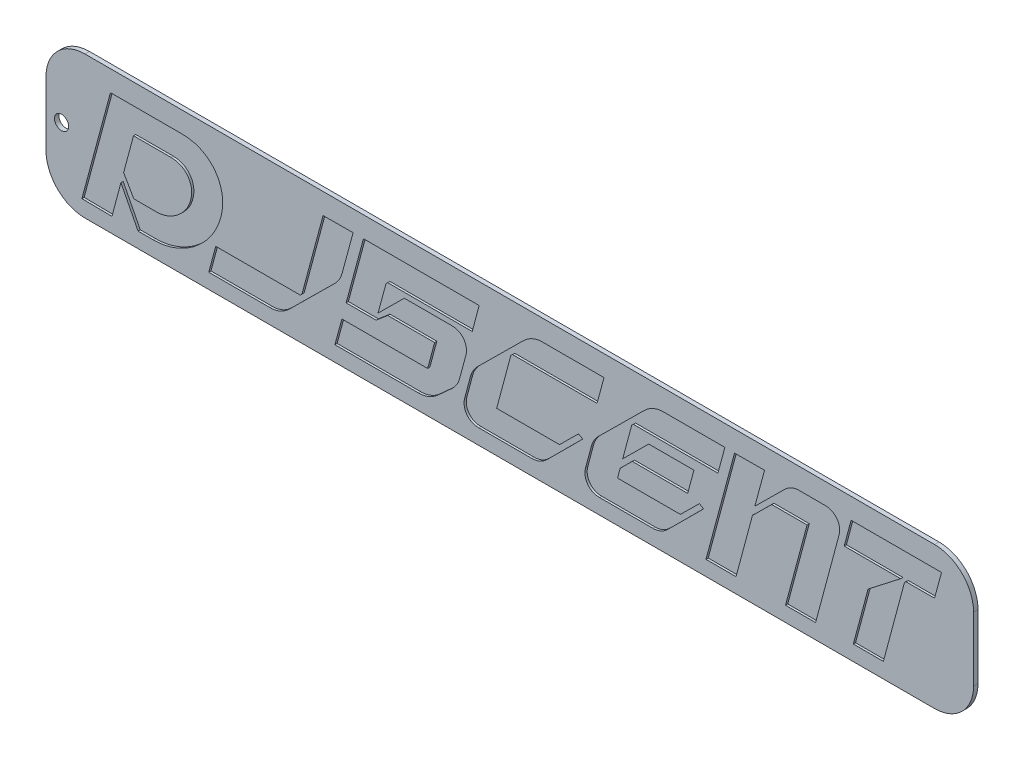
from build123d import *

# Parameters (mm, degrees)
SKETCH1_R           = 5.08
BOSS_EXTRUDE1_DEPTH = 3.175
CUT_EXTRUDE1_DEPTH  = 1.5875


with BuildPart() as part:
    # Sketch1 → Boss-Extrude1 (new body)
    with BuildSketch(Plane.XY):
        with BuildLine():
            Line((-2.764141927, 90.936625215), (605.615617234, 90.936625215))
            ThreePointArc((605.615617234, 90.936625215), (625.3721807, 82.753188682), (633.555617234, 62.996625215))
            Line((633.555617234, 62.996625215), (633.555617234, 17.11091705))
            ThreePointArc((633.555617234, 17.11091705), (625.3721807, -2.645646417), (605.615617234, -10.82908295))
            Line((605.615617234, -10.82908295), (-2.764141927, -10.82908295))
            ThreePointArc((-2.764141927, -10.82908295), (-22.520705393, -2.645646417), (-30.704141927, 17.11091705))
            Line((-30.704141927, 17.11091705), (-30.704141927, 62.996625215))
            ThreePointArc((-30.704141927, 62.996625215), (-22.520705393, 82.753188682), (-2.764141927, 90.936625215))
        make_face()
        with Locations((-19.559430626, 40.053771132)):
            Circle(SKETCH1_R, mode=Mode.SUBTRACT)
    extrude(amount=BOSS_EXTRUDE1_DEPTH)

    # Sketch2 → Cut-Extrude1 (cut)
    # profile 1 of 7: a face of its own
    with BuildSketch(Plane.XY.offset(3.175)):
        with BuildLine():
            add(Edge.make_bspline(
                [(66.52755418, 76.089907121), (67.372046712, 76.074563137), (69.038183134, 76.044290317), (71.489589408, 75.812285952), (73.845177593, 75.390891794), (76.117142602, 74.853952709), (78.292207484, 74.123799588), (80.378486199, 73.238050653), (82.376877109, 72.205541894), (84.266662619, 71.004514799), (86.036664601, 69.671624878), (87.680567722, 68.227807443), (89.16165676, 66.653649777), (90.528332882, 64.990829421), (91.717934334, 63.185445615), (92.780666176, 61.281570002), (93.673962142, 59.248927318), (94.442092708, 57.122681404), (95.058969633, 54.916479497), (95.475759652, 52.646760168), (95.755304974, 50.335546754), (95.818025954, 47.968966832), (95.751332865, 45.550704159), (95.469056183, 43.088680838), (95.05013987, 40.56989186), (94.434408682, 38.029814448), (93.662114402, 35.485257913), (92.755633009, 32.972704117), (91.694961723, 30.512238042), (90.499744842, 28.098479964), (89.144621863, 25.734962281), (87.627485234, 23.430297223), (85.992884695, 21.152887344), (84.207829513, 18.951907167), (82.307792362, 16.836425189), (80.32466496, 14.814740203), (78.252117947, 12.919218972), (76.097089586, 11.12686239), (73.864836797, 9.451422185), (71.530987286, 7.905177139), (69.133677175, 6.455977404), (66.654599677, 5.140210603), (64.134521609, 3.964590867), (61.591692305, 2.941376078), (59.050830919, 2.052719211), (56.490834784, 1.345608044), (53.92810321, 0.793616553), (51.359979832, 0.401456803), (48.786467063, 0.155160065), (47.067869031, 0.125127109), (46.20755418, 0.110092879)],
                knots=[0, 0, 0, 0, 1.003930024, 1.980697652, 2.923385203, 3.847007251, 4.753628863, 5.647304237, 6.53934812, 7.424638552, 8.305927004, 9.171336687, 10.022193025, 10.87293522, 11.726867652, 12.588904283, 13.46220048, 14.363170224, 15.274961464, 16.181968607, 17.104264897, 18.039671939, 18.993766563, 19.978002109, 20.983169548, 22.027755318, 23.082610034, 24.14332209, 25.201485874, 26.266236942, 27.343879609, 28.438137729, 29.545224554, 30.675317922, 31.805222221, 32.92466118, 34.040711709, 35.142751948, 36.255892392, 37.357015791, 38.469719939, 39.584987061, 40.691968618, 41.774107702, 42.842409923, 43.890318653, 44.929386156, 45.957177089, 46.977381066, 48, 48, 48, 48], degree=3))
            Line((46.20755418, 0.110092879), (35.229721362, 0.110092879))
            Line((35.229721362, 0.110092879), (22.946501548, 24.031702786))
            Line((22.946501548, 24.031702786), (16.529659443, -0.110092879))
            Line((16.529659443, -0.110092879), (-5.001362229, 0.110092879))
            Line((-5.001362229, 0.110092879), (15.444458204, 76.089907121))
            Line((15.444458204, 76.089907121), (66.52755418, 76.089907121))
        make_face()
        with BuildLine():
            add(Edge.make_bspline(
                [(63.539318885, 24.299071207), (64.123361521, 24.778148003), (65.275103398, 25.722895482), (66.851663558, 27.266675021), (68.249643028, 28.899453309), (69.522947593, 30.577102489), (70.607093678, 32.35200104), (71.545592756, 34.193383799), (72.290973634, 36.122833261), (72.904507078, 38.08617619), (73.347213085, 40.051989801), (73.5916202, 41.975246756), (73.613716997, 43.824219923), (73.494305733, 45.60113709), (73.114412945, 47.290466295), (72.583941957, 48.91615916), (71.839686114, 50.466372683), (70.89433666, 51.91182426), (69.819584889, 53.257039485), (68.587831137, 54.420401782), (67.232835591, 55.415036936), (65.746326529, 56.21072894), (64.140883349, 56.855077394), (62.403668964, 57.28057906), (60.544245451, 57.558163088), (59.262496591, 57.59237237), (58.600866873, 57.61003096)],
                knots=[0, 0, 0, 0, 1.195095478, 2.356748335, 3.486132587, 4.594569455, 5.685984208, 6.773133445, 7.860852384, 8.95516448, 10.026046227, 11.045862362, 12.016715015, 12.948937795, 13.85695938, 14.748996516, 15.650742299, 16.568978341, 17.477303105, 18.369340241, 19.242227615, 20.129506361, 21.030794017, 21.972530458, 22.953434527, 24, 24, 24, 24], degree=3))
            Line((58.600866873, 57.61003096), (31.958390093, 57.61003096))
            Line((31.958390093, 57.61003096), (24.896718266, 31.203467492))
            Line((24.896718266, 31.203467492), (32.178575851, 18.58996904))
            Line((32.178575851, 18.58996904), (48.157770898, 18.58996904))
            add(Edge.make_bspline(
                [(48.157770898, 18.58996904), (48.834963529, 18.608962724), (50.184069689, 18.646802026), (52.188714512, 18.92573168), (54.165085905, 19.360934592), (56.104399242, 19.99820026), (58.016085011, 20.808450529), (59.906542844, 21.77825385), (61.755156819, 22.954450814), (62.937100682, 23.845213964), (63.539318885, 24.299071207)],
                knots=[0, 0, 0, 0, 0.971579504, 1.935584991, 2.899326218, 3.872419268, 4.860319757, 5.876520275, 6.918055092, 8, 8, 8, 8], degree=3))
        make_face(mode=Mode.SUBTRACT)
    # profile 2 of 7: a face of its own
    with BuildSketch(Plane.XY.offset(3.175)):
        with BuildLine():
            Line((167.702910217, 75.979814241), (189.218204334, 76.089907121))
            Line((189.218204334, 76.089907121), (181.401609907, 47.182662539))
            add(Edge.make_bspline(
                [(181.401609907, 47.182662539), (181.148974403, 46.339319712), (180.643546052, 44.652108821), (179.415455317, 42.266911666), (177.885461761, 39.983388952), (176.609458265, 38.625916589), (175.959876161, 37.934860681)],
                knots=[0, 0, 0, 0, 0.971438497, 1.94348201, 2.953077097, 4, 4, 4, 4], degree=3))
            Line((175.959876161, 37.934860681), (143.891393189, 6.196656347))
            add(Edge.make_bspline(
                [(143.891393189, 6.196656347), (143.365831062, 5.693326875), (142.337804807, 4.708788826), (140.672643334, 3.439883558), (138.981839967, 2.336437681), (137.233540932, 1.437364182), (135.431150151, 0.737281505), (133.578125119, 0.254801864), (131.681938002, -0.061311318), (130.398415372, -0.093759348), (129.752321981, -0.110092879)],
                knots=[0, 0, 0, 0, 1.097274323, 2.146324394, 3.153497661, 4.1405882, 5.107243582, 6.064727515, 7.025831931, 8, 8, 8, 8], degree=3))
            Line((129.752321981, -0.110092879), (85.840990712, -0.110092879))
            Line((85.840990712, -0.110092879), (90.842352941, 18.479876161))
            Line((90.842352941, 18.479876161), (151.393436533, 18.479876161))
            Line((151.393436533, 18.479876161), (152.58873065, 19.675170279))
            Line((152.58873065, 19.675170279), (167.702910217, 75.979814241))
        make_face()
    # profile 3 of 7: a face of its own
    with BuildSketch(Plane.XY.offset(3.175)):
        with BuildLine():
            Line((214.020557276, 57.49993808), (212.809535604, 56.304643963))
            Line((212.809535604, 56.304643963), (207.053250774, 35.119628483))
            Line((207.053250774, 35.119628483), (225.863405573, 53.803962848))
            Line((225.863405573, 53.803962848), (259.772012384, 53.803962848))
            add(Edge.make_bspline(
                [(259.772012384, 53.803962848), (260.228797235, 53.792536655), (261.120241453, 53.770237725), (262.417437426, 53.577414152), (263.636727991, 53.264495868), (264.774066422, 52.825289363), (265.823260925, 52.256984862), (266.776163423, 51.548204168), (267.662687397, 50.734643286), (268.437524179, 49.79006535), (269.119210499, 48.773848382), (269.657801448, 47.678870984), (270.050593045, 46.5260999), (270.305194191, 45.321874174), (270.407593633, 44.065632036), (270.398792306, 42.757932078), (270.218335828, 41.392968483), (269.998251725, 40.480925875), (269.884829721, 40.010897833)],
                knots=[0, 0, 0, 0, 1.087139332, 2.121620428, 3.114679227, 4.079000668, 5.01744495, 5.946209128, 6.900133268, 7.875060797, 8.847908392, 9.808100651, 10.771290354, 11.74076863, 12.730763032, 13.76689966, 14.849154885, 16, 16, 16, 16], degree=3))
            Line((269.884829721, 40.010897833), (265.433931889, 23.591331269))
            add(Edge.make_bspline(
                [(265.433931889, 23.591331269), (265.182709387, 22.773271161), (264.678240967, 21.130562064), (263.426983646, 18.840139037), (261.846010447, 16.682431718), (260.5469083, 15.42657403), (259.882105263, 14.783900929)],
                knots=[0, 0, 0, 0, 0.970695336, 1.949208918, 2.950527376, 4, 4, 4, 4], degree=3))
            Line((259.882105263, 14.783900929), (250.319752322, 6.086563467))
            add(Edge.make_bspline(
                [(250.319752322, 6.086563467), (249.777653868, 5.60949808), (248.713172031, 4.67271725), (247.000765226, 3.470110923), (245.277410875, 2.416407118), (243.49155523, 1.579966816), (241.67414936, 0.909720101), (239.803843417, 0.463976892), (237.904802036, 0.161676246), (236.622236745, 0.127371698), (235.97622291, 0.110092879)],
                knots=[0, 0, 0, 0, 1.088269915, 2.136961561, 3.151199837, 4.13085782, 5.106263281, 6.066978306, 7.026358528, 8, 8, 8, 8], degree=3))
            Line((235.97622291, 0.110092879), (176.18006192, 0.110092879))
            Line((176.18006192, 0.110092879), (181.181424149, 18.58996904))
            Line((181.181424149, 18.58996904), (242.59752322, 18.58996904))
            Line((242.59752322, 18.58996904), (247.598885449, 37.17993808))
            Line((247.598885449, 37.17993808), (214.020557276, 37.17993808))
            Line((214.020557276, 37.17993808), (205.747863777, 30.118266254))
            Line((205.747863777, 30.118266254), (184.232569659, 30.118266254))
            Line((184.232569659, 30.118266254), (196.625882353, 76.089907121))
            Line((196.625882353, 76.089907121), (279.462910217, 76.089907121))
            Line((279.462910217, 76.089907121), (274.555913313, 57.49993808))
            Line((274.555913313, 57.49993808), (214.020557276, 57.49993808))
        make_face()
    # profile 4 of 7: a face of its own
    with BuildSketch(Plane.XY.offset(3.175)):
        with BuildLine():
            Line((303.353065015, 57.61003096), (302.157770898, 56.414736842))
            Line((302.157770898, 56.414736842), (292.04495356, 18.58996904))
            Line((292.04495356, 18.58996904), (337.057213622, 18.58996904))
            Line((337.057213622, 18.58996904), (350.645820433, 32.068482972))
            Line((350.645820433, 32.068482972), (353.68123839, 30.322724458))
            Line((353.68123839, 30.322724458), (328.029597523, 4.781176471))
            add(Edge.make_bspline(
                [(328.029597523, 4.781176471), (327.633266989, 4.40563779), (326.856078214, 3.669221032), (325.586307927, 2.72983858), (324.294121277, 1.922007685), (322.967225193, 1.249330178), (321.591786548, 0.749693532), (320.185853978, 0.386207664), (318.742039624, 0.157196007), (317.765585027, 0.125909425), (317.271950464, 0.110092879)],
                knots=[0, 0, 0, 0, 1.087710149, 2.132957327, 3.142311131, 4.123953504, 5.092881289, 6.053713067, 7.016078678, 8, 8, 8, 8], degree=3))
            Line((317.271950464, 0.110092879), (279.226996904, 0.110092879))
            add(Edge.make_bspline(
                [(279.226996904, 0.110092879), (278.770211077, 0.121495697), (277.878764955, 0.143749009), (276.581582553, 0.336897705), (275.366980441, 0.647440779), (274.238421993, 1.086514673), (273.208763493, 1.669343073), (272.235339213, 2.337531495), (271.369730793, 3.167267257), (270.6030024, 4.11011912), (269.945021087, 5.138224272), (269.427143746, 6.234858978), (269.020365153, 7.369301457), (268.794149875, 8.568042434), (268.679141028, 9.811604079), (268.716874511, 11.108834081), (268.88752335, 12.453440135), (269.110110305, 13.3493112), (269.224272446, 13.80879257)],
                knots=[0, 0, 0, 0, 1.094945795, 2.136855229, 3.137044923, 4.096584279, 5.030749513, 5.969051044, 6.920650617, 7.894578144, 8.878114772, 9.839711021, 10.797931648, 11.759527897, 12.756631189, 13.787866602, 14.865423694, 16, 16, 16, 16], degree=3))
            Line((269.224272446, 13.80879257), (273.250526316, 28.922972136))
            add(Edge.make_bspline(
                [(273.250526316, 28.922972136), (273.51226104, 29.762249011), (274.037110847, 31.445229009), (275.315795229, 33.789754209), (276.844888304, 36.050838621), (278.13039495, 37.371021477), (278.786625387, 38.04495356)],
                knots=[0, 0, 0, 0, 0.975136166, 1.955415087, 2.956272335, 4, 4, 4, 4], degree=3))
            Line((278.786625387, 38.04495356), (310.855108359, 69.798885449))
            add(Edge.make_bspline(
                [(310.855108359, 69.798885449), (311.3812917, 70.301463912), (312.407534861, 71.281669234), (314.060301474, 72.559024637), (315.744674897, 73.662817435), (317.494157, 74.531301715), (319.271052523, 75.247349918), (321.105730167, 75.724007994), (322.980543696, 76.040497331), (324.248450589, 76.073408073), (324.884086687, 76.089907121)],
                knots=[0, 0, 0, 0, 1.104987577, 2.155115633, 3.169368792, 4.159784375, 5.118388166, 6.074904324, 7.034897349, 8, 8, 8, 8], degree=3))
            Line((324.884086687, 76.089907121), (368.905510836, 76.089907121))
            Line((368.905510836, 76.089907121), (363.904148607, 57.61003096))
            Line((363.904148607, 57.61003096), (303.353065015, 57.61003096))
        make_face()
    # profile 5 of 7: a face of its own
    with BuildSketch(Plane.XY.offset(3.175)):
        with BuildLine():
            Line((389.91752322, 57.61003096), (388.722229102, 56.414736842))
            Line((388.722229102, 56.414736842), (382.305386997, 32.39876161))
            Line((382.305386997, 32.39876161), (400.895356037, 50.878637771))
            Line((400.895356037, 50.878637771), (433.294117647, 50.878637771))
            Line((433.294117647, 50.878637771), (428.843219814, 34.238885449))
            Line((428.843219814, 34.238885449), (389.162600619, 34.238885449))
            Line((389.162600619, 34.238885449), (380.465263158, 25.651640867))
            Line((380.465263158, 25.651640867), (378.609411765, 18.58996904))
            Line((378.609411765, 18.58996904), (423.621671827, 18.58996904))
            Line((423.621671827, 18.58996904), (437.210278638, 32.068482972))
            Line((437.210278638, 32.068482972), (440.245696594, 30.322724458))
            Line((440.245696594, 30.322724458), (414.594055728, 4.781176471))
            add(Edge.make_bspline(
                [(414.594055728, 4.781176471), (414.197725193, 4.40563779), (413.420536418, 3.669221032), (412.150766132, 2.72983858), (410.858579482, 1.922007685), (409.531683398, 1.249330178), (408.156244752, 0.749693532), (406.750312183, 0.386207664), (405.306497828, 0.157196007), (404.330043231, 0.125909425), (403.836408669, 0.110092879)],
                knots=[0, 0, 0, 0, 1.087710149, 2.132957327, 3.142311131, 4.123953504, 5.092881289, 6.053713067, 7.016078678, 8, 8, 8, 8], degree=3))
            Line((403.836408669, 0.110092879), (365.791455108, 0.110092879))
            add(Edge.make_bspline(
                [(365.791455108, 0.110092879), (365.334669281, 0.121495697), (364.443223159, 0.143749009), (363.146040757, 0.336897705), (361.931438645, 0.647440779), (360.802880197, 1.086514673), (359.773221697, 1.669343073), (358.799797417, 2.337531495), (357.934188998, 3.167267257), (357.167460604, 4.11011912), (356.509479291, 5.138224272), (355.991601951, 6.234858978), (355.584823357, 7.369301457), (355.358608079, 8.568042434), (355.243599232, 9.811604079), (355.281332716, 11.108834081), (355.451981554, 12.453440135), (355.674568509, 13.3493112), (355.78873065, 13.80879257)],
                knots=[0, 0, 0, 0, 1.094945795, 2.136855229, 3.137044923, 4.096584279, 5.030749513, 5.969051044, 6.920650617, 7.894578144, 8.878114772, 9.839711021, 10.797931648, 11.759527897, 12.756631189, 13.787866602, 14.865423694, 16, 16, 16, 16], degree=3))
            Line((355.78873065, 13.80879257), (359.81498452, 28.922972136))
            add(Edge.make_bspline(
                [(359.81498452, 28.922972136), (360.076719244, 29.762249011), (360.601569052, 31.445229009), (361.880253433, 33.789754209), (363.409346508, 36.050838621), (364.694853155, 37.371021477), (365.351083591, 38.04495356)],
                knots=[0, 0, 0, 0, 0.975136166, 1.955415087, 2.956272335, 4, 4, 4, 4], degree=3))
            Line((365.351083591, 38.04495356), (397.419566563, 69.798885449))
            add(Edge.make_bspline(
                [(397.419566563, 69.798885449), (397.945749904, 70.301463912), (398.971993066, 71.281669234), (400.624759678, 72.559024637), (402.309133101, 73.662817435), (404.058615204, 74.531301715), (405.835510727, 75.247349918), (407.670188371, 75.724007994), (409.5450019, 76.040497331), (410.812908794, 76.073408073), (411.448544892, 76.089907121)],
                knots=[0, 0, 0, 0, 1.104987577, 2.155115633, 3.169368792, 4.159784375, 5.118388166, 6.074904324, 7.034897349, 8, 8, 8, 8], degree=3))
            Line((411.448544892, 76.089907121), (455.46996904, 76.089907121))
            Line((455.46996904, 76.089907121), (450.468606811, 57.61003096))
            Line((450.468606811, 57.61003096), (389.91752322, 57.61003096))
        make_face()
    # profile 6 of 7: a face of its own
    with BuildSketch(Plane.XY.offset(3.175)):
        with BuildLine():
            add(Edge.make_bspline(
                [(527.030340557, 75.979814241), (527.487125412, 75.96838805), (528.378569637, 75.946089122), (529.67576556, 75.753265531), (530.895056305, 75.440347312), (532.032394095, 75.001140575), (533.081590906, 74.432836909), (534.034484843, 73.724053119), (534.921041789, 72.910504162), (535.695752281, 71.965880548), (536.377908919, 70.949833691), (536.912578585, 69.858693237), (537.309375922, 68.718158749), (537.563378718, 67.529264566), (537.666039261, 66.288698388), (537.656842914, 64.996679474), (537.478204124, 63.652201513), (537.256742743, 62.756325839), (537.143157895, 62.296842105)],
                knots=[0, 0, 0, 0, 1.092991326, 2.13304096, 3.131445324, 4.100957639, 5.0444535, 5.97821715, 6.937276196, 7.91745169, 8.895536054, 9.86089696, 10.817407172, 11.77982689, 12.762650102, 13.791815242, 14.867448903, 16, 16, 16, 16], degree=3))
            Line((537.143157895, 62.296842105), (520.409040248, -0.110092879))
            Line((520.409040248, -0.110092879), (498.878018576, -0.110092879))
            Line((498.878018576, -0.110092879), (514.32247678, 57.405572755))
            Line((514.32247678, 57.405572755), (488.985386997, 57.405572755))
            Line((488.985386997, 57.405572755), (475.396780186, 43.911331269))
            Line((475.396780186, 43.911331269), (475.286687307, 44.021424149))
            Line((475.286687307, 44.021424149), (463.443839009, -0.110092879))
            Line((463.443839009, -0.110092879), (441.912817337, -0.110092879))
            Line((441.912817337, -0.110092879), (462.358637771, 75.979814241))
            Line((462.358637771, 75.979814241), (483.873931889, 76.089907121))
            Line((483.873931889, 76.089907121), (476.922352941, 50.328173375))
            Line((476.922352941, 50.328173375), (498.013003096, 71.198637771))
            add(Edge.make_bspline(
                [(498.013003096, 71.198637771), (498.410943255, 71.577188987), (499.190434246, 72.318700635), (500.436074904, 73.303761259), (501.730598851, 74.114204336), (503.042186705, 74.809775832), (504.403119414, 75.322665393), (505.791249628, 75.707773792), (507.216931321, 75.930755526), (508.177507721, 75.963398777), (508.660557276, 75.979814241)],
                knots=[0, 0, 0, 0, 1.099200487, 2.15312996, 3.172151549, 4.153175518, 5.119892887, 6.077164679, 7.033054793, 8, 8, 8, 8], degree=3))
            Line((508.660557276, 75.979814241), (527.030340557, 75.979814241))
        make_face()
    # profile 7 of 7: a face of its own
    with BuildSketch(Plane.XY.offset(3.175)):
        Polygon((610.606563467, 76.089907121), (605.605201238, 57.61003096), (585.285201238, 57.61003096), (584.089907121, 56.634922601), (568.975727554, 0.110092879), (547.444705882, 0.110092879), (557.997894737, 39.460433437), (581.369040248, 57.61003096), (540.933498452, 57.61003096), (545.824767802, 76.089907121), align=None)
    extrude(amount=-CUT_EXTRUDE1_DEPTH, mode=Mode.SUBTRACT)


solid = part.part
